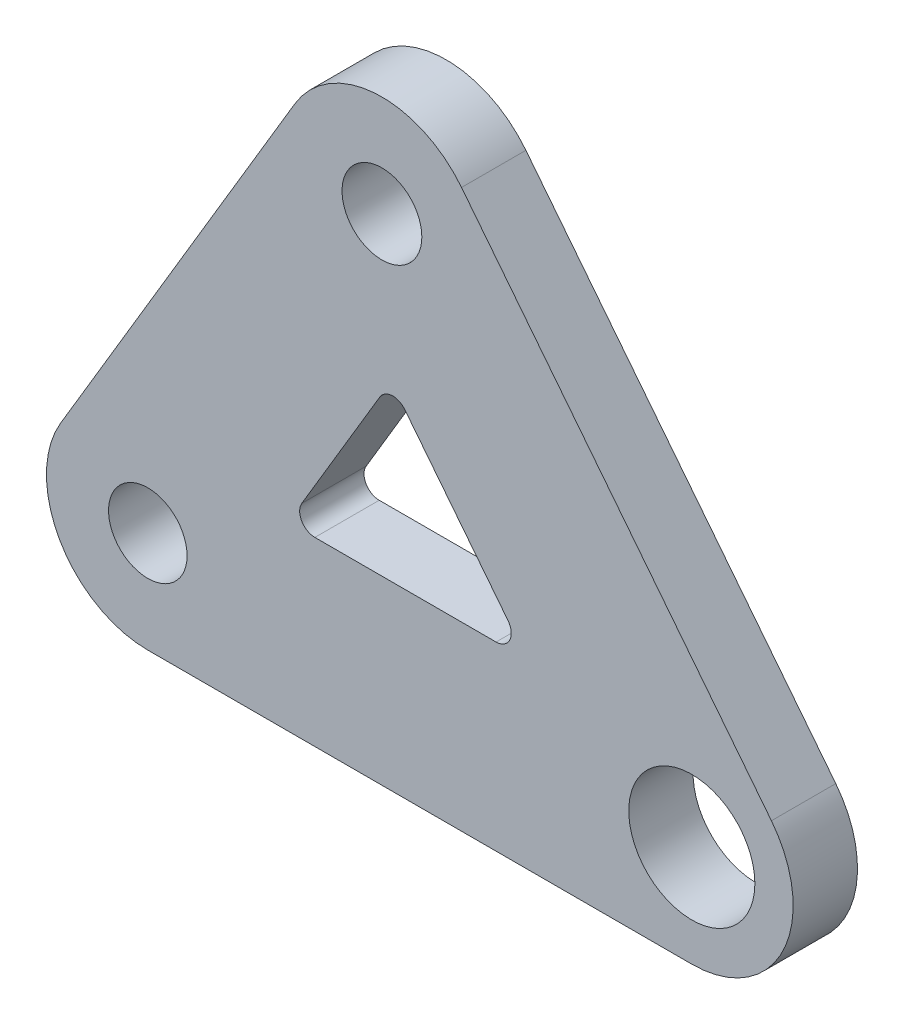
from build123d import *

# Parameters (mm, degrees)
SKETCH1_R           = 10
SKETCH1_R_2         = 3.875
SKETCH1_R_3         = 3.9375
SKETCH1_R_4         = 6.223
BOSS_EXTRUDE1_DEPTH = 6.35
FILLET1_R           = 1.5


with BuildPart() as part:
    # Sketch1 → Boss-Extrude1 (new body)
    # profile 1 of 4: a face of its own
    with BuildSketch(Plane.XY):
        with BuildLine():
            Line((-8.593850937, 5.113289165), (-31.697797638, -33.717269329))
            ThreePointArc((-31.697797638, -33.717269329), (-20.452391437, -29.188501934), (-13.103946701, -38.830558493))
            ThreePointArc((-13.103946701, -38.830558493), (-16.032878889, -45.901626305), (-23.103946701, -48.830558493))
            Line((-23.103946701, -48.830558493), (30.579912659, -48.830558493))
            ThreePointArc((30.579912659, -48.830558493), (21.583526758, -34.464205241), (38.436192426, -32.643566638))
            Line((38.436192426, -32.643566638), (7.856279768, 6.186991855))
            ThreePointArc((7.856279768, 6.186991855), (9.44888347, 3.273927483), (10, 0))
            ThreePointArc((10, 0), (-2.651555264, -9.642056559), (-8.593850937, 5.113289165))
        make_face()
        Polygon((-9.254840748, -30.955558493), (0.905857228, -13.878581033), (14.354349844, -30.955558493), align=None, mode=Mode.SUBTRACT)
    # profile 2 of 4: a face of its own
    with BuildSketch(Plane.XY):
        with Locations((-23.103946701, -38.830558493)):
            Circle(SKETCH1_R)
        with Locations((-23.103946701, -38.830558493)):
            Circle(SKETCH1_R_2, mode=Mode.SUBTRACT)
    # profile 3 of 4: a face of its own
    with BuildSketch(Plane.XY):
        Circle(SKETCH1_R)
        Circle(SKETCH1_R_3, mode=Mode.SUBTRACT)
    # profile 4 of 4: a face of its own
    with BuildSketch(Plane.XY):
        with Locations((30.579912659, -38.830558493)):
            Circle(SKETCH1_R)
        with Locations((30.579912659, -38.830558493)):
            Circle(SKETCH1_R_4, mode=Mode.SUBTRACT)
    extrude(amount=BOSS_EXTRUDE1_DEPTH)

    # Fillet1
    fillet1_edges = [part.edges().sort_by_distance(p)[0] for p in [
        (0.905857228, -13.878581033, 3.175),
        (-9.254840748, -30.955558493, 3.175),
        (14.354349844, -30.955558493, 3.175),
    ]]
    fillet(fillet1_edges, radius=FILLET1_R)


solid = part.part
